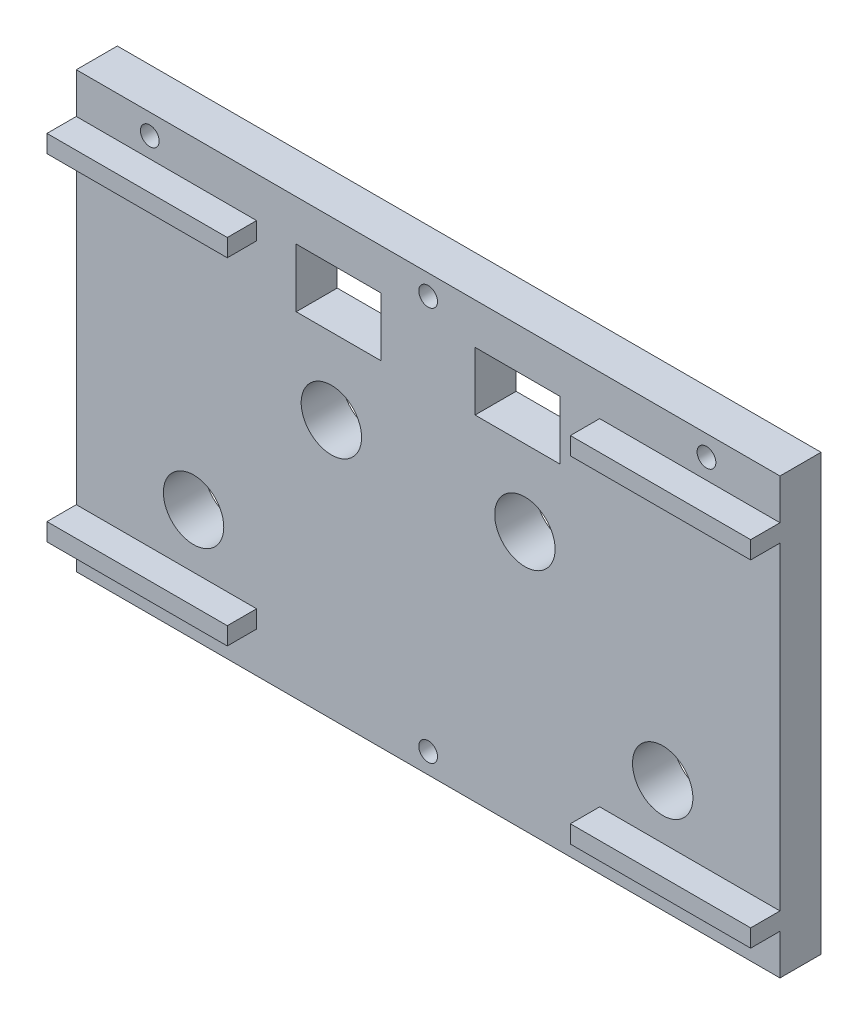
from build123d import *

# Parameters (mm, degrees)
ESBO_O1_R                = 1.6
ESBO_O1_R_2              = 5.15
ESBO_O1_W                = 14.5
ESBO_O1_H                = 10
ESBO_O1_W_2              = 30.747802568
ESBO_O1_H_2              = 3
ESBO_O1_W_3              = 30.747802569
RESSALTO_EXTRUS_O1_DEPTH = 7
RESSALTO_EXTRUS_O3_START = 7
ESBO_O1_5_W              = 30.747802569
ESBO_O1_5_H              = 3
ESBO_O1_5_W_2            = 30.747802568
RESSALTO_EXTRUS_O3_DEPTH = 5


with BuildPart() as part:
    # Esboço1 → Ressalto-extrusão1 (new body)
    # profile 1 of 5: a face of its own
    with BuildSketch(Plane.XY):
        Polygon((60.087398189, 33.548797322), (-59.912601811, 33.548797322), (-59.912601811, 26.644004496), (-29.164799242, 26.644004496), (-29.164799242, 23.644004496), (-59.912601811, 23.644004496), (-59.912601811, -30.686339735), (-29.164799242, -30.686339735), (-29.164799242, -33.686339735), (-59.912601811, -33.686339735), (-59.912601811, -40.591132561), (60.087398189, -40.591132561), (60.087398189, -33.686339735), (29.339595621, -33.686339735), (29.339595621, -30.686339735), (60.087398189, -30.686339735), (60.087398189, 23.644004496), (29.339595621, 23.644004496), (29.339595621, 26.644004496), (60.087398189, 26.644004496), align=None)
        with Locations((-47.375288378, -37.09616762)):
            Circle(ESBO_O1_R, mode=Mode.SUBTRACT)
        with Locations((0.087398189, -37.13140726)):
            Circle(ESBO_O1_R, mode=Mode.SUBTRACT)
        with Locations((-39.912601811, -21.441132561)):
            Circle(ESBO_O1_R_2, mode=Mode.SUBTRACT)
        with Locations((47.550084756, -37.09616762)):
            Circle(ESBO_O1_R, mode=Mode.SUBTRACT)
        with Locations((40.087398189, -21.441132561)):
            Circle(ESBO_O1_R_2, mode=Mode.SUBTRACT)
        with Locations((-16.412601811, 3.558867439)):
            Circle(ESBO_O1_R_2, mode=Mode.SUBTRACT)
        with Locations((-47.375288378, 30.05383238)):
            Circle(ESBO_O1_R, mode=Mode.SUBTRACT)
        with Locations((-15.162601811, 21.548797322)):
            Rectangle(ESBO_O1_W, ESBO_O1_H, mode=Mode.SUBTRACT)
        with Locations((0.087398189, 30.08907202)):
            Circle(ESBO_O1_R, mode=Mode.SUBTRACT)
        with Locations((16.587398189, 3.558867439)):
            Circle(ESBO_O1_R_2, mode=Mode.SUBTRACT)
        with Locations((15.337398189, 21.548797322)):
            Rectangle(ESBO_O1_W, ESBO_O1_H, mode=Mode.SUBTRACT)
        with Locations((47.550084756, 30.05383238)):
            Circle(ESBO_O1_R, mode=Mode.SUBTRACT)
    # profile 2 of 5: a face of its own
    with BuildSketch(Plane.XY):
        Polygon((-29.164799242, -30.686339735), (-59.912601811, -30.686339735), (-59.912601811, -33.451202678), (-59.912601811, -33.686339735), (-29.164799242, -33.686339735), align=None)
    # profile 3 of 5: a face of its own
    with BuildSketch(Plane.XY):
        Polygon((60.087398189, -33.646676702), (60.087398189, -30.686339735), (29.339595621, -30.686339735), (29.339595621, -33.686339735), (60.087398189, -33.686339735), align=None)
    # profile 4 of 5: a face of its own
    with BuildSketch(Plane.XY):
        with Locations((44.713496905, 25.144004496)):
            Rectangle(ESBO_O1_W_2, ESBO_O1_H_2)
    # profile 5 of 5: a face of its own
    with BuildSketch(Plane.XY):
        with Locations((-44.538700527, 25.144004496)):
            Rectangle(ESBO_O1_W_3, ESBO_O1_H_2)
    extrude(amount=RESSALTO_EXTRUS_O1_DEPTH)

    # Esboço1<5> → Ressalto-extrusão3 (add)
    with BuildSketch(Plane.XY.offset(RESSALTO_EXTRUS_O3_START)):
        with Locations((-44.538700527, 25.144004496)):
            Rectangle(ESBO_O1_5_W, ESBO_O1_5_H)
        with Locations((44.713496905, 25.144004496)):
            Rectangle(ESBO_O1_5_W_2, ESBO_O1_5_H)
        Polygon((-29.164799242, -30.686339735), (-59.912601811, -30.686339735), (-59.912601811, -33.451202678), (-59.912601811, -33.686339735), (-29.164799242, -33.686339735), align=None)
        Polygon((60.087398189, -33.646676702), (60.087398189, -30.686339735), (29.339595621, -30.686339735), (29.339595621, -33.686339735), (60.087398189, -33.686339735), align=None)
    extrude(amount=RESSALTO_EXTRUS_O3_DEPTH)


solid = part.part
